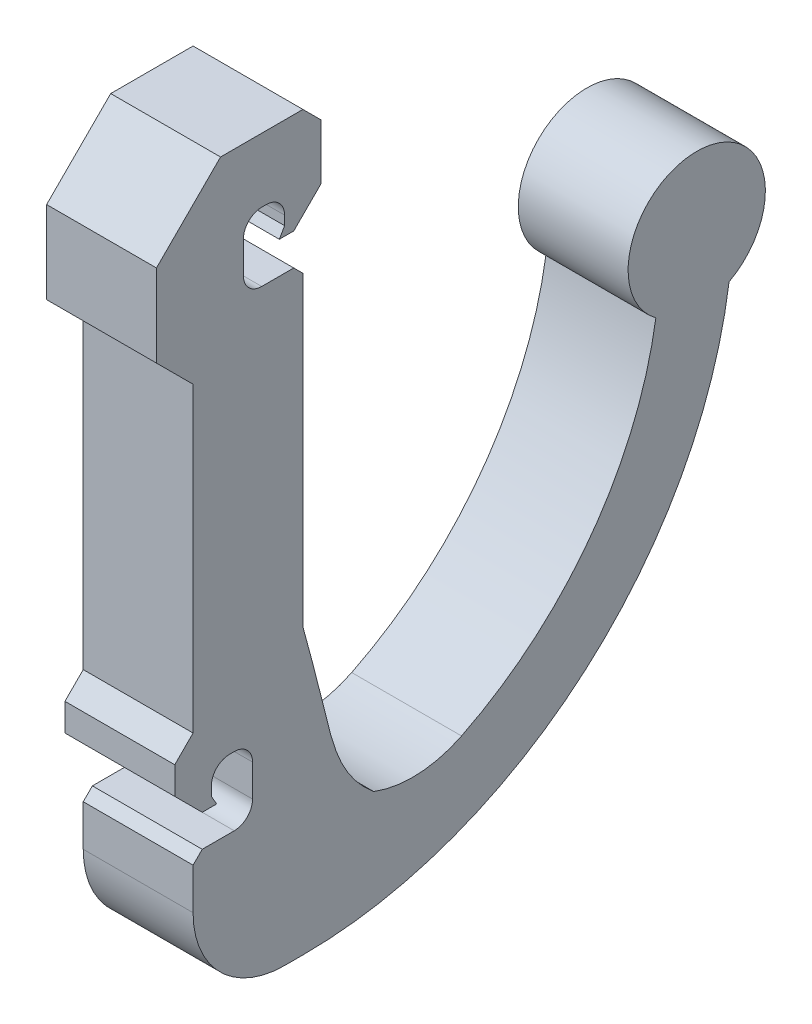
from build123d import *

# Parameters (mm, degrees)
BOSS_EXTRUDE1_DEPTH = 12
FILLET1_R           = 12
FILLET2_R           = 10
CUT_EXTRUDE1_DEPTH  = 12
CHAMFER1_SIZE       = 3
FILLET3_R           = 2
BOSS_EXTRUDE2_DEPTH = 12
BOSS_EXTRUDE3_DEPTH = 12
CHAMFER2_SIZE       = 1


with BuildPart() as part:
    # Sketch2 → Boss-Extrude1 (new body)
    with BuildSketch(Plane(origin=(0, 0, 0), x_dir=(0, 0, -1), z_dir=(1, 0, 0))):
        with BuildLine():
            Line((-6, 40), (6, 40))
            Line((6, 40), (6, -32))
            ThreePointArc((6, -32), (31.376089713, -22.623144998), (44.55766945, 1.001361229))
            ThreePointArc((44.55766945, 1.001361229), (49.578973365, 14.504959969), (52.55766945, 0.409285399))
            ThreePointArc((52.55766945, 0.409285399), (36.824206929, -28.488778663), (6, -40))
            Line((6, -40), (-6, -40))
            Line((-6, -40), (-6, 40))
        make_face()
    extrude(amount=BOSS_EXTRUDE1_DEPTH)

    # Fillet1
    fillet1_edges = [part.edges().sort_by_distance(p)[0] for p in [
        (6, -32, -6),
    ]]
    fillet(fillet1_edges, radius=FILLET1_R)

    # Fillet2
    fillet2_edges = [part.edges().sort_by_distance(p)[0] for p in [
        (6, -40, 6),
    ]]
    fillet(fillet2_edges, radius=FILLET2_R)

    # Sketch3 → Cut-Extrude1 (cut)
    with BuildSketch(Plane(origin=(12, 0, 0), x_dir=(0, 0, -1), z_dir=(1, 0, 0))):
        Polygon((-6, -20), (-4, -20), (-4, -17), (0.5, -17), (0.5, -20), (0.5, -24.5), (-6, -24.5), align=None)
        Polygon((6, 30), (4, 30), (4, 33), (-0.5, 33), (-0.5, 30), (-0.5, 25.5), (6, 25.5), align=None)
    extrude(amount=-CUT_EXTRUDE1_DEPTH, mode=Mode.SUBTRACT)

    # Chamfer1
    chamfer1_edges = [part.edges().sort_by_distance(p)[0] for p in [
        (6, 40, 6),
    ]]
    chamfer(chamfer1_edges, length=CHAMFER1_SIZE)

    # Fillet3
    fillet3_edges = [part.edges().sort_by_distance(p)[0] for p in [
        (6, -17, 4),
        (6, -17, -0.5),
        (6, -24.5, -0.5),
        (6, 25.5, 0.5),
        (6, 33, 0.5),
        (6, 33, -4),
    ]]
    fillet(fillet3_edges, radius=FILLET3_R)

    # Sketch4 → Boss-Extrude2 (add)
    with BuildSketch(Plane(origin=(12, 0, 0), x_dir=(0, 0, -1), z_dir=(1, 0, 0))):
        Polygon((6, 30), (8, 32), (8, 38), (6, 40), align=None)
        Polygon((-6, -20), (-8, -18), (-8, -15), (-6, -13), align=None)
        Polygon((-6, 37), (-10, 33), (-10, 24), (-6, 20), align=None)
        with BuildLine():
            Line((6, -8.96976203), (3.756023672, -12.28945594))
            Line((3.756023672, -12.28945594), (6, -29.586808416))
            Line((6, -29.586808416), (13.733193293, -28.4055347))
            add(Edge.make_bspline(
                [(6, -8.96976203), (8.392195381, -17.703259611), (9.041325817, -20.67605108), (9.22470807, -24.630513259), (13.733193293, -28.4055347)],
                knots=[0, 0, 0, 0, 0, 1, 1, 1, 1, 1], degree=4))
        make_face()
    extrude(amount=-BOSS_EXTRUDE2_DEPTH)

    # Sketch5 → Boss-Extrude3 (add)
    with BuildSketch(Plane(origin=(12, 0, 0), x_dir=(0, 0, -1), z_dir=(1, 0, 0))):
        Polygon((6, 30), (5, 29), (4, 29), (3.422649731, 29), (4, 30), align=None)
        Polygon((-6, -20), (-5, -21), (-4, -21), (-3.422649731, -21), (-4, -20), align=None)
    extrude(amount=-BOSS_EXTRUDE3_DEPTH)

    # Chamfer2
    chamfer2_edges = [part.edges().sort_by_distance(p)[0] for p in [
        (6, -24.5, 6),
        (6, 25.5, -6),
    ]]
    chamfer(chamfer2_edges, length=CHAMFER2_SIZE)


solid = part.part
